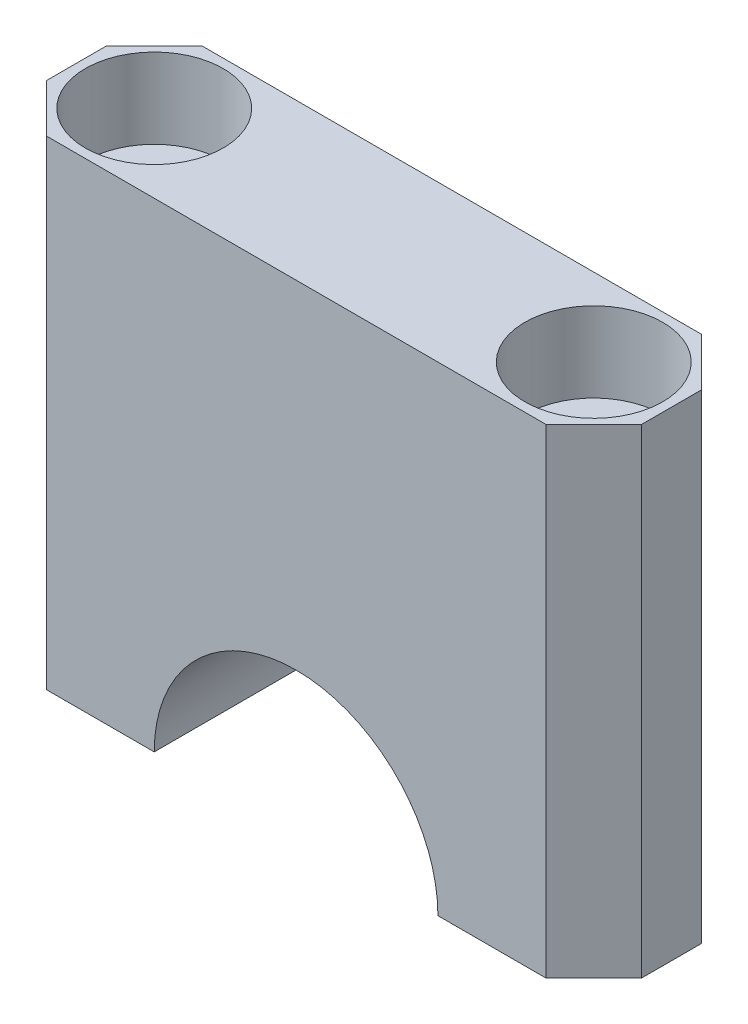
from build123d import *

# Parameters (mm, degrees)
SZKIC1_R                    = 2.1
DODANIE_WYCI_GNI_CIE1_DEPTH = 24
WYTNIJ_WYCI_GNI_CIE1_REACH  = 31.306
SZKIC3_R                    = 3.45
WYTNIJ_WYCI_GNI_CIE2_DEPTH  = 4


with BuildPart() as part:
    # Szkic1 → Dodanie-wyciągnięcie1 (new body)
    with BuildSketch(Plane(origin=(0, 0, 0), x_dir=(1, 0, 0), z_dir=(0, 1, 0))):
        Polygon((12.5, 3.9), (-12.5, 3.9), (-14.9, 1.5), (-14.9, -1.5), (-12.5, -3.9), (12.5, -3.9), (14.9, -1.5), (14.9, 1.5), align=None)
        with Locations(Location((-11, 0, 0), (0, 0, 270))):
            Circle(SZKIC1_R, mode=Mode.SUBTRACT)
        with Locations(Location((11, 0, 0), (0, 0, 90))):
            Circle(SZKIC1_R, mode=Mode.SUBTRACT)
    extrude(amount=-DODANIE_WYCI_GNI_CIE1_DEPTH)

    # Szkic2 → Wytnij-wyciągnięcie1 (cut, up to next)
    with BuildSketch(Plane(origin=(0, 0, -3.9), x_dir=(-1, 0, 0), z_dir=(0, 0, -1)), mode=Mode.PRIVATE) as wytnij_wyci_gni_cie1_sk1:
        with BuildLine():
            Line((-7.1, -24), (7.1, -24))
            ThreePointArc((7.1, -24), (0, -16.9), (-7.1, -24))
        make_face()
    wytnij_wyci_gni_cie1_tool1 = extrude(wytnij_wyci_gni_cie1_sk1.sketch, amount=-WYTNIJ_WYCI_GNI_CIE1_REACH, mode=Mode.PRIVATE) & part.part
    add(wytnij_wyci_gni_cie1_tool1.solids().sort_by_distance((0, -20.986666, -3.9))[0], mode=Mode.SUBTRACT)

    # Szkic3 → Wytnij-wyciągnięcie2 (cut)
    with BuildSketch(Plane(origin=(0, 0, 0), x_dir=(1, 0, 0), z_dir=(0, 1, 0))):
        with Locations(Location((-11, 0, 0), (0, 0, 270))):
            Circle(SZKIC3_R)
        with Locations(Location((11, 0, 0), (0, 0, 90))):
            Circle(SZKIC3_R)
    extrude(amount=-WYTNIJ_WYCI_GNI_CIE2_DEPTH, mode=Mode.SUBTRACT)


solid = part.part
